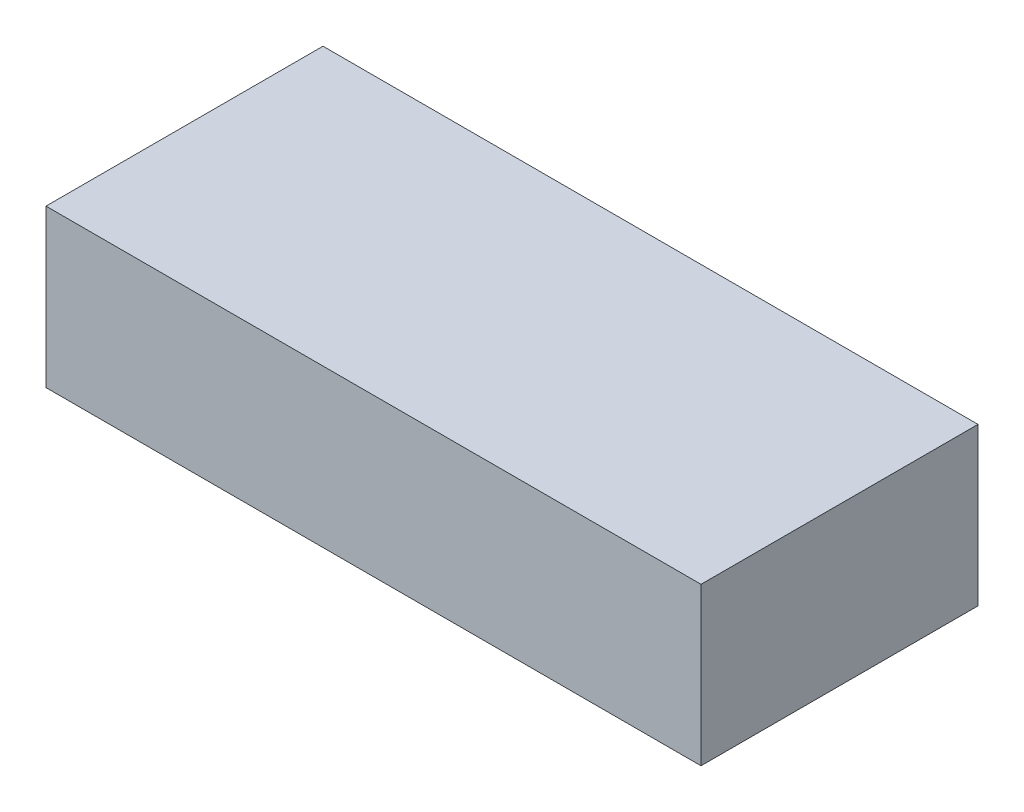
from build123d import *

# Parameters (mm, degrees)
SKETCH1_W           = 875
SKETCH1_H           = 370
BOSS_EXTRUDE1_DEPTH = 210


with BuildPart() as part:
    # Sketch1 → Boss-Extrude1 (new body)
    with BuildSketch(Plane(origin=(0, 0, 0), x_dir=(1, 0, 0), z_dir=(0, 1, 0))):
        with Locations((0, 185)):
            Rectangle(SKETCH1_W, SKETCH1_H)
    extrude(amount=-BOSS_EXTRUDE1_DEPTH)


solid = part.part
